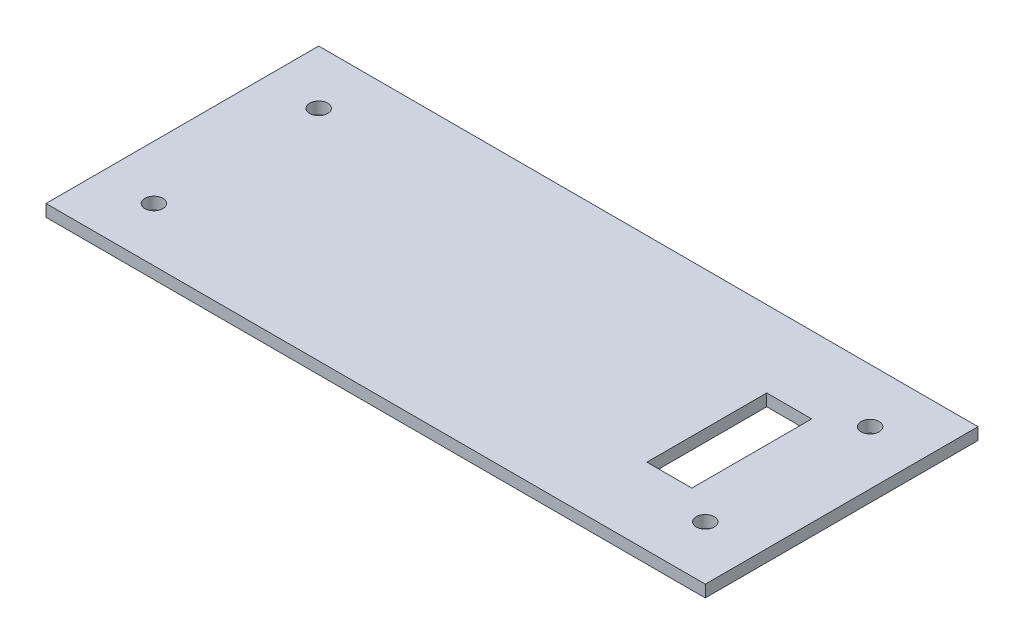
from build123d import *

# Parameters (mm, degrees)
SKETCH1_W           = 110
SKETCH1_H           = 45.5
BOSS_EXTRUDE1_DEPTH = 2
CUT_EXTRUDE1_REACH  = 61.553
SKETCH2_R           = 1.5
SKETCH2_W           = 7.5
SKETCH2_H           = 20


with BuildPart() as part:
    # Sketch1 → Boss-Extrude1 (new body)
    with BuildSketch(Plane(origin=(0, 0, 0), x_dir=(1, 0, 0), z_dir=(0, 1, 0))):
        Rectangle(SKETCH1_W, SKETCH1_H)
    extrude(amount=BOSS_EXTRUDE1_DEPTH)

    # Sketch2 → Cut-Extrude1 (cut, up to next)
    with BuildSketch(Plane(origin=(0, 2, 0), x_dir=(1, 0, 0), z_dir=(0, 1, 0)), mode=Mode.PRIVATE) as cut_extrude1_sk1:
        with Locations(Location((-46, -13.75, 0), (0, 0, 270))):
            Circle(SKETCH2_R)
    cut_extrude1_tool1 = extrude(cut_extrude1_sk1.sketch, amount=-CUT_EXTRUDE1_REACH, mode=Mode.PRIVATE) & part.part
    # Sketch2 → Cut-Extrude1 (cut, up to next)
    with BuildSketch(Plane(origin=(0, 2, 0), x_dir=(1, 0, 0), z_dir=(0, 1, 0)), mode=Mode.PRIVATE) as cut_extrude1_sk2:
        with Locations(Location((-46, 13.75, 0), (0, 0, 270))):
            Circle(SKETCH2_R)
    cut_extrude1_tool2 = extrude(cut_extrude1_sk2.sketch, amount=-CUT_EXTRUDE1_REACH, mode=Mode.PRIVATE) & part.part
    # Sketch2 → Cut-Extrude1 (cut, up to next)
    with BuildSketch(Plane(origin=(0, 2, 0), x_dir=(1, 0, 0), z_dir=(0, 1, 0)), mode=Mode.PRIVATE) as cut_extrude1_sk3:
        with Locations(Location((46, 13.75, 0), (0, 0, 270))):
            Circle(SKETCH2_R)
    cut_extrude1_tool3 = extrude(cut_extrude1_sk3.sketch, amount=-CUT_EXTRUDE1_REACH, mode=Mode.PRIVATE) & part.part
    # Sketch2 → Cut-Extrude1 (cut, up to next)
    with BuildSketch(Plane(origin=(0, 2, 0), x_dir=(1, 0, 0), z_dir=(0, 1, 0)), mode=Mode.PRIVATE) as cut_extrude1_sk4:
        with Locations(Location((46, -13.75, 0), (0, 0, 270))):
            Circle(SKETCH2_R)
    cut_extrude1_tool4 = extrude(cut_extrude1_sk4.sketch, amount=-CUT_EXTRUDE1_REACH, mode=Mode.PRIVATE) & part.part
    # Sketch2 → Cut-Extrude1 (cut, up to next)
    with BuildSketch(Plane(origin=(0, 2, 0), x_dir=(1, 0, 0), z_dir=(0, 1, 0)), mode=Mode.PRIVATE) as cut_extrude1_sk5:
        with Locations((36.25, 0)):
            Rectangle(SKETCH2_W, SKETCH2_H)
    cut_extrude1_tool5 = extrude(cut_extrude1_sk5.sketch, amount=-CUT_EXTRUDE1_REACH, mode=Mode.PRIVATE) & part.part
    add(cut_extrude1_tool1.solids().sort_by_distance((-46, 2, 13.75))[0], mode=Mode.SUBTRACT)
    add(cut_extrude1_tool2.solids().sort_by_distance((-46, 2, -13.75))[0], mode=Mode.SUBTRACT)
    add(cut_extrude1_tool3.solids().sort_by_distance((46, 2, -13.75))[0], mode=Mode.SUBTRACT)
    add(cut_extrude1_tool4.solids().sort_by_distance((46, 2, 13.75))[0], mode=Mode.SUBTRACT)
    add(cut_extrude1_tool5.solids().sort_by_distance((36.25, 2, 0))[0], mode=Mode.SUBTRACT)


solid = part.part
